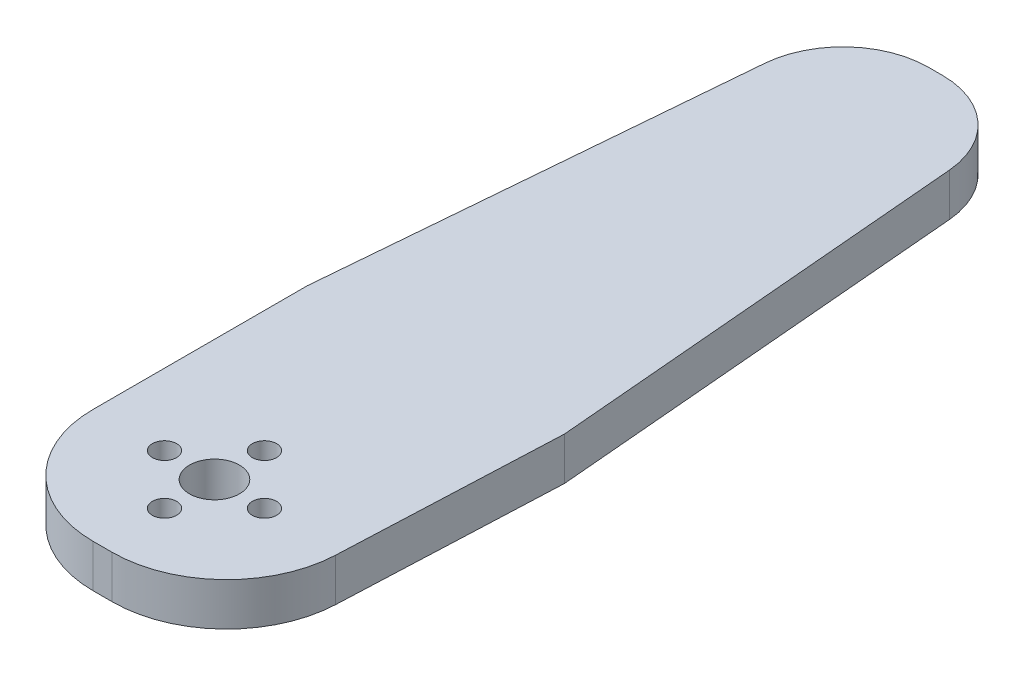
from build123d import *

# Parameters (mm, degrees)
BOSS_1_DEPTH  = 6
S_CYL2_R      = 12.5
BOSS_2_DEPTH  = 2
S_HOLE3_R     = 3.5
HOLE_3_DEPTH  = 8.2
S_HOLE4_R     = 1.7
HOLE_4_DEPTH  = 8.2
S_HOLE5_R     = 1.7
HOLE_5_DEPTH  = 8.2
S_HOLE6_R     = 1.7
HOLE_6_DEPTH  = 8.2
S_HOLE7_R     = 1.7
HOLE_7_DEPTH  = 8.2
S_HOLE8_R     = 3.2
HOLE_8_DEPTH  = 5.1
S_HOLE9_R     = 3.2
HOLE_9_DEPTH  = 5.1
S_HOLE10_R    = 3.2
HOLE_10_DEPTH = 5.1
S_HOLE11_R    = 3.2
HOLE_11_DEPTH = 5.1


with BuildPart() as part:
    # S_prism1 → Boss_1 (new body)
    with BuildSketch(Plane(origin=(0, -6, 0), x_dir=(1, 0, 0), z_dir=(0, 1, 0))):
        with BuildLine():
            Line((-1, -16), (1.6805, -16))
            ThreePointArc((1.6805, -16), (12.745771818, -11.556826983), (17.6654, -0.695))
            Line((17.6654, -0.695), (19, 30))
            Line((19, 30), (13.9407, 89.0248))
            ThreePointArc((13.9407, 89.0248), (10.099439666, 96.840163588), (1.9846, 100))
            Line((1.9846, 100), (0.0154, 100))
            ThreePointArc((0.0154, 100), (-8.099439666, 96.840163588), (-11.9407, 89.0248))
            Line((-11.9407, 89.0248), (-17, 30))
            Line((-17, 30), (-17, 0))
            ThreePointArc((-17, 0), (-12.3137, -11.3137), (-1, -16))
        make_face()
    extrude(amount=BOSS_1_DEPTH)

    # S_cyl2 → Boss_2 (add)
    with BuildSketch(Plane(origin=(0, -8, 0), x_dir=(1, 0, 0), z_dir=(0, 1, 0))):
        with Locations(Location((0, 0, 0), (0, 0, 270))):
            Circle(S_CYL2_R)
    extrude(amount=BOSS_2_DEPTH)

    # S_hole3 → Hole_3 (cut)
    with BuildSketch(Plane(origin=(0, -8.1, 0), x_dir=(1, 0, 0), z_dir=(0, 1, 0))):
        with Locations(Location((0, 0, 0), (0, 0, 270))):
            Circle(S_HOLE3_R)
    extrude(amount=HOLE_3_DEPTH, mode=Mode.SUBTRACT)

    # S_hole4 → Hole_4 (cut)
    with BuildSketch(Plane(origin=(0, -8.1, 0), x_dir=(1, 0, 0), z_dir=(0, 1, 0))):
        with Locations(Location((7, 0, 0), (0, 0, 270))):
            Circle(S_HOLE4_R)
    extrude(amount=HOLE_4_DEPTH, mode=Mode.SUBTRACT)

    # S_hole5 → Hole_5 (cut)
    with BuildSketch(Plane(origin=(0, -8.1, 0), x_dir=(1, 0, 0), z_dir=(0, 1, 0))):
        with Locations(Location((0, -7, 0), (0, 0, 270))):
            Circle(S_HOLE5_R)
    extrude(amount=HOLE_5_DEPTH, mode=Mode.SUBTRACT)

    # S_hole6 → Hole_6 (cut)
    with BuildSketch(Plane(origin=(0, -8.1, 0), x_dir=(1, 0, 0), z_dir=(0, 1, 0))):
        with Locations(Location((-7, 0, 0), (0, 0, 270))):
            Circle(S_HOLE6_R)
    extrude(amount=HOLE_6_DEPTH, mode=Mode.SUBTRACT)

    # S_hole7 → Hole_7 (cut)
    with BuildSketch(Plane(origin=(0, -8.1, 0), x_dir=(1, 0, 0), z_dir=(0, 1, 0))):
        with Locations(Location((0, 7, 0), (0, 0, 270))):
            Circle(S_HOLE7_R)
    extrude(amount=HOLE_7_DEPTH, mode=Mode.SUBTRACT)

    # S_hole8 → Hole_8 (cut)
    with BuildSketch(Plane(origin=(0, -8.1, 0), x_dir=(1, 0, 0), z_dir=(0, 1, 0))):
        with Locations(Location((7, 0, 0), (0, 0, 270))):
            Circle(S_HOLE8_R)
    extrude(amount=HOLE_8_DEPTH, mode=Mode.SUBTRACT)

    # S_hole9 → Hole_9 (cut)
    with BuildSketch(Plane(origin=(0, -8.1, 0), x_dir=(1, 0, 0), z_dir=(0, 1, 0))):
        with Locations(Location((0, -7, 0), (0, 0, 270))):
            Circle(S_HOLE9_R)
    extrude(amount=HOLE_9_DEPTH, mode=Mode.SUBTRACT)

    # S_hole10 → Hole_10 (cut)
    with BuildSketch(Plane(origin=(0, -8.1, 0), x_dir=(1, 0, 0), z_dir=(0, 1, 0))):
        with Locations(Location((-7, 0, 0), (0, 0, 270))):
            Circle(S_HOLE10_R)
    extrude(amount=HOLE_10_DEPTH, mode=Mode.SUBTRACT)

    # S_hole11 → Hole_11 (cut)
    with BuildSketch(Plane(origin=(0, -8.1, 0), x_dir=(1, 0, 0), z_dir=(0, 1, 0))):
        with Locations(Location((0, 7, 0), (0, 0, 270))):
            Circle(S_HOLE11_R)
    extrude(amount=HOLE_11_DEPTH, mode=Mode.SUBTRACT)


solid = part.part
